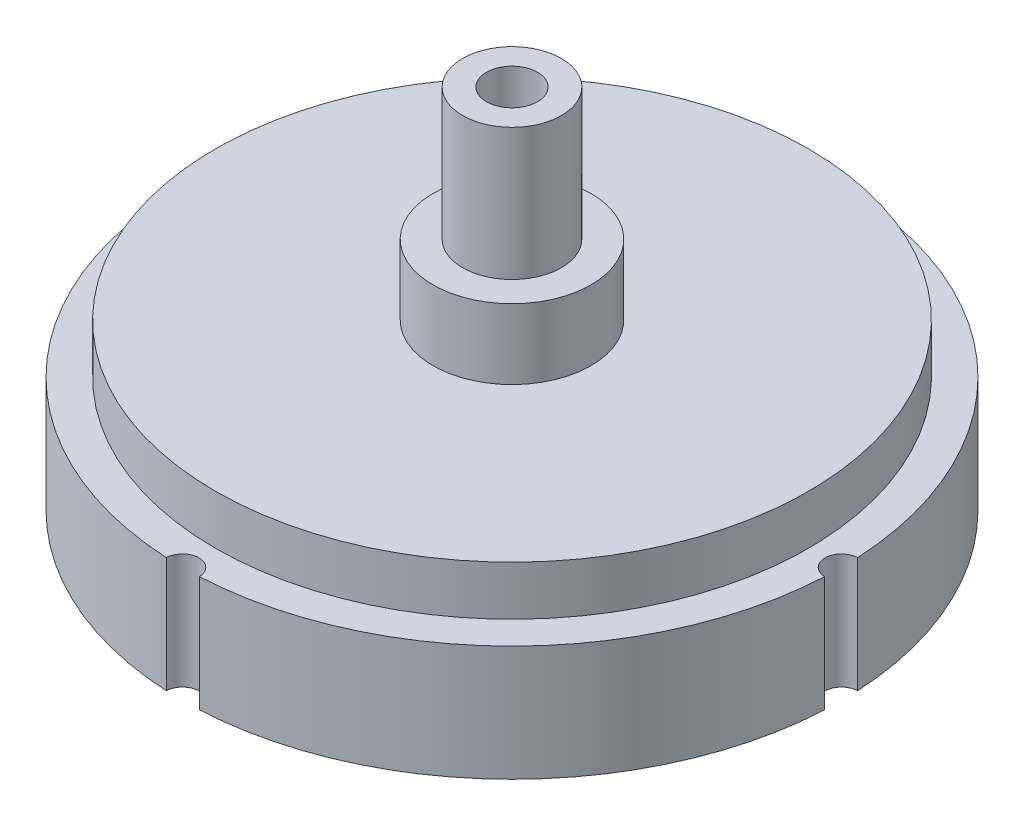
from build123d import *

# Parameters (mm, degrees)
CUT_EXTRUDE1_DEPTH      = 18.993488406
CUT_EXTRUDE1_DEPTH_BACK = 18.993488406
SKETCH5_R               = 0.5


with BuildPart() as part:
    # Sketch4 → Revolve1 (revolve)
    with BuildSketch(Plane.XY, mode=Mode.PRIVATE) as revolve1_sk:
        Polygon((-0.775, 11.125), (-0.775, 4), (-1.2, 4), (-1.2, 0), (-10, 0), (-10, 3.5), (-9, 3.5), (-9, 5), (-2.4, 5), (-2.4, 7.125), (-1.5, 7.125), (-1.5, 11.125), align=None)
    revolve(revolve1_sk.sketch.rotate(Axis((0, 0, 0), (0, 1, 0)), 270), axis=Axis((0, 0, 0), (0, 1, 0)))

    # Sketch5 → Cut-Extrude1 (cut, two sides: drawn at the far end of the back side and taken through both)
    with BuildSketch(Plane.XZ.offset(-CUT_EXTRUDE1_DEPTH_BACK)):
        with Locations((0, 10)):
            Circle(SKETCH5_R)
        with Locations((10, 0)):
            Circle(SKETCH5_R)
        with Locations((0, -10)):
            Circle(SKETCH5_R)
        with Locations((-10, 0)):
            Circle(SKETCH5_R)
    extrude(amount=CUT_EXTRUDE1_DEPTH + CUT_EXTRUDE1_DEPTH_BACK, mode=Mode.SUBTRACT)


solid = part.part
